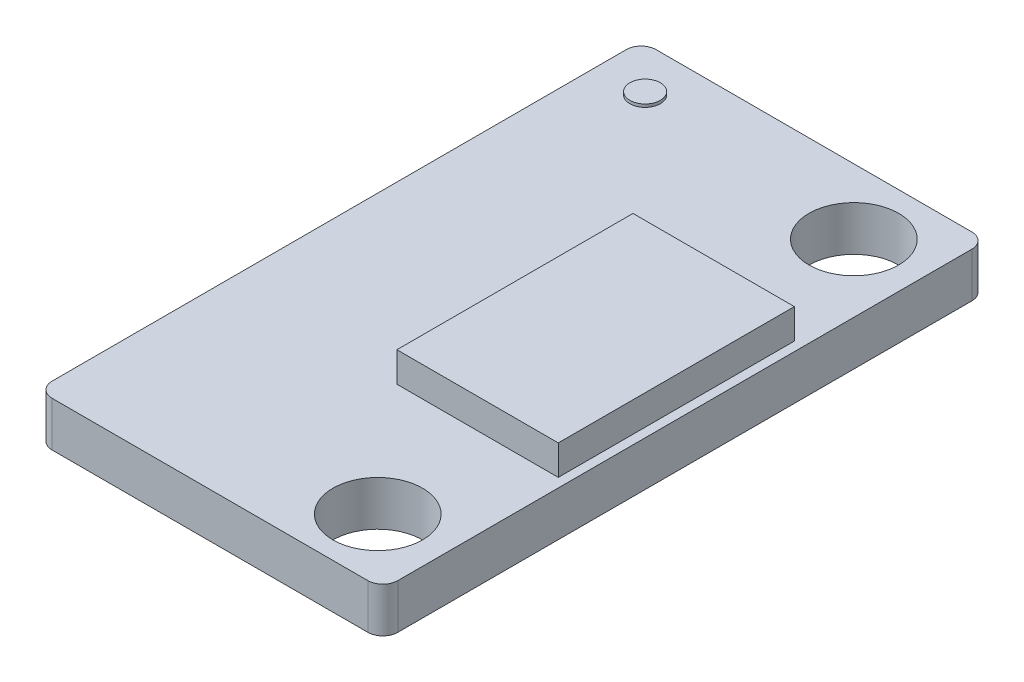
from build123d import *

# Parameters (mm, degrees)
SKETCH1_W           = 11.566360694
SKETCH1_H           = 20.211316514
BOSS_EXTRUDE1_DEPTH = 1.5
SKETCH1_4_W         = 5.4
SKETCH1_4_H         = 7.9
BOSS_EXTRUDE2_DEPTH = 1
SKETCH1_5_R         = 0.51
BOSS_EXTRUDE3_DEPTH = 0.1
SKETCH2_R           = 1.5
CUT_EXTRUDE1_DEPTH  = 2.1
FILLET1_R           = 0.5


with BuildPart() as part:
    # Sketch1 → Boss-Extrude1 (new body)
    with BuildSketch(Plane(origin=(0, 0, 0), x_dir=(1, 0, 0), z_dir=(0, 1, 0))):
        with Locations((-2.777214228, -0.021219212)):
            Rectangle(SKETCH1_W, SKETCH1_H)
    extrude(amount=-BOSS_EXTRUDE1_DEPTH)

    # Sketch1<4> → Boss-Extrude2 (add)
    with BuildSketch(Plane(origin=(0, 0, 0), x_dir=(1, 0, 0), z_dir=(0, 1, 0))):
        Rectangle(SKETCH1_4_W, SKETCH1_4_H)
    extrude(amount=BOSS_EXTRUDE2_DEPTH)

    # Sketch1<5> → Boss-Extrude3 (add)
    with BuildSketch(Plane(origin=(0, 0, 0), x_dir=(1, 0, 0), z_dir=(0, 1, 0))):
        with Locations((-6.930111953, 8.586389213)):
            Circle(SKETCH1_5_R)
    extrude(amount=BOSS_EXTRUDE3_DEPTH)

    # Sketch2 → Cut-Extrude1 (cut)
    with BuildSketch(Plane(origin=(0, 0, 0), x_dir=(1, 0, 0), z_dir=(0, 1, 0))):
        with Locations((0.741742268, 7.899498536)):
            Circle(SKETCH2_R)
        with Locations((0.741742268, -8.032859578)):
            Circle(SKETCH2_R)
    extrude(amount=-CUT_EXTRUDE1_DEPTH, mode=Mode.SUBTRACT)

    # Fillet1
    fillet1_edges = [part.edges().sort_by_distance(p)[0] for p in [
        (3.005966119, -0.75, -10.084439045),
        (-8.560394575, -0.75, -10.084439045),
        (-8.560394575, -0.75, 10.126877469),
        (3.005966119, -0.75, 10.126877469),
    ]]
    fillet(fillet1_edges, radius=FILLET1_R)


solid = part.part
